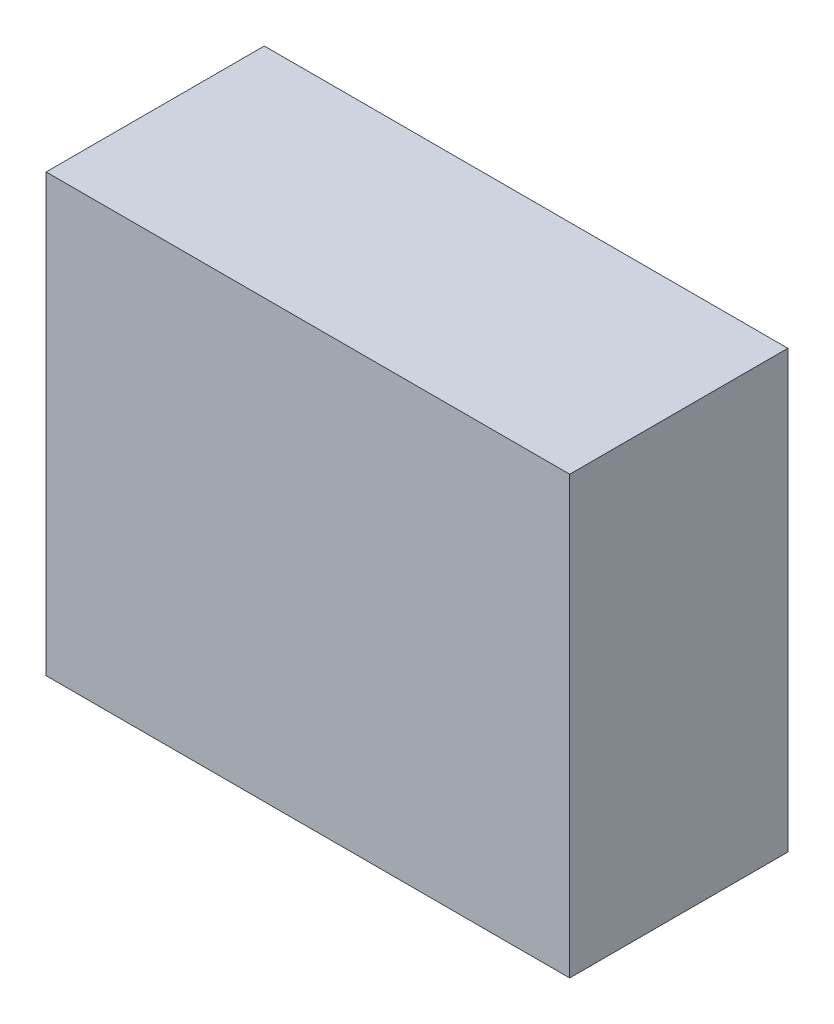
from build123d import *

# Parameters (mm, degrees)
SK_BOX_0_W  = 96
SK_BOX_0_H  = 80
BOX_0_DEPTH = 40


with BuildPart() as part:
    # SK_Box_0 → Box_0 (new body)
    with BuildSketch(Plane.XY.offset(98)):
        with Locations((-20, 0)):
            Rectangle(SK_BOX_0_W, SK_BOX_0_H)
    extrude(amount=BOX_0_DEPTH)


solid = part.part
